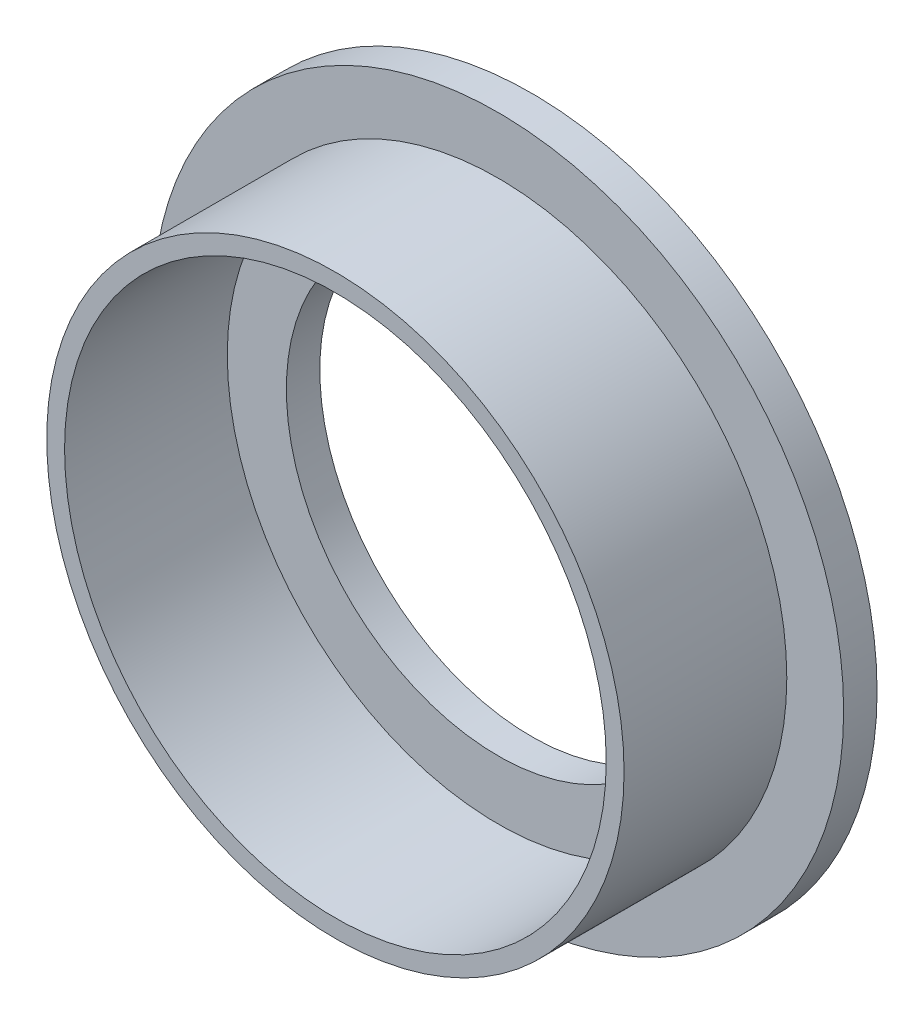
from build123d import *

# Parameters (mm, degrees)
CROQUIS3_R              = 15.5
CROQUIS3_R_2            = 9.5
SALIENTE_EXTRUIR3_DEPTH = 1.5
CROQUIS4_R              = 12.95
CROQUIS4_R_2            = 12.15
SALIENTE_EXTRUIR4_DEPTH = 7.3


with BuildPart() as part:
    # Croquis3 → Saliente-Extruir3 (new body)
    with BuildSketch(Plane.XY):
        with Locations((38, 0)):
            Circle(CROQUIS3_R)
        with Locations((38, 0)):
            Circle(CROQUIS3_R_2, mode=Mode.SUBTRACT)
    extrude(amount=SALIENTE_EXTRUIR3_DEPTH)

    # Croquis4 → Saliente-Extruir4 (add)
    with BuildSketch(Plane.XY.offset(1.5)):
        with Locations((38, 0)):
            Circle(CROQUIS4_R)
        with Locations((38, 0)):
            Circle(CROQUIS4_R_2, mode=Mode.SUBTRACT)
    extrude(amount=SALIENTE_EXTRUIR4_DEPTH)


solid = part.part
